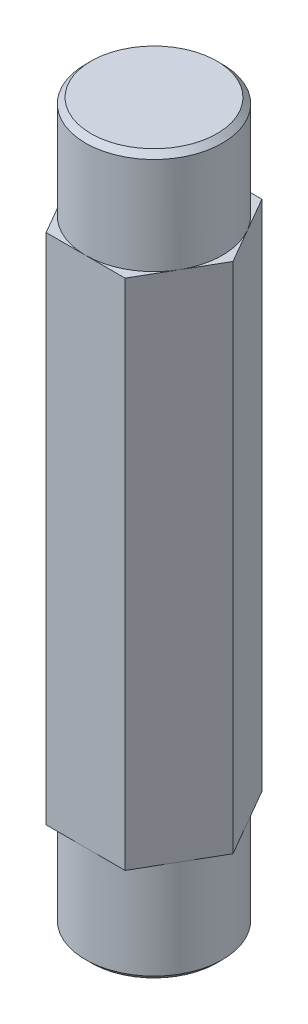
from build123d import *

# Parameters (mm, degrees)
BOSS_EXTRUDE1_DEPTH = 47.625
SKETCH2_R           = 6.35
BOSS_EXTRUDE2_DEPTH = 9.525
BOSS_EXTRUDE3_START = 9.525
SKETCH3_R           = 6.35
BOSS_EXTRUDE3_DEPTH = 9.525
CHAMFER2_SIZE       = 0.508


with BuildPart() as part:
    # Sketch1 → Boss-Extrude1 (new body)
    with BuildSketch(Plane(origin=(0, 0, 0), x_dir=(1, 0, 0), z_dir=(0, 1, 0))):
        Polygon((3.666174209, -6.35), (7.332348419, 0), (3.666174209, 6.35), (-3.666174209, 6.35), (-7.332348419, 0), (-3.666174209, -6.35), align=None)
    extrude(amount=BOSS_EXTRUDE1_DEPTH)

    # Sketch2 → Boss-Extrude2 (add)
    with BuildSketch(Plane(origin=(0, 0, 0), x_dir=(-1, 0, 0), z_dir=(0, -1, 0))):
        with Locations(Location((0, 0, 0), (0, 0, 90))):
            Circle(SKETCH2_R)
    extrude(amount=BOSS_EXTRUDE2_DEPTH)

    # Sketch3 → Boss-Extrude3 (add)
    with BuildSketch(Plane(origin=(0, 47.625, 0), x_dir=(1, 0, 0), z_dir=(0, 1, 0)).offset(BOSS_EXTRUDE3_START)):
        with Locations(Location((0, 0, 0), (0, 0, 90))):
            Circle(SKETCH3_R)
    extrude(amount=-BOSS_EXTRUDE3_DEPTH)

    # Chamfer2
    chamfer2_edges = [part.edges().sort_by_distance(p)[0] for p in [
        (0, -9.525, 6.35),
        (0, 57.15, 6.35),
    ]]
    chamfer(chamfer2_edges, length=CHAMFER2_SIZE)


solid = part.part
